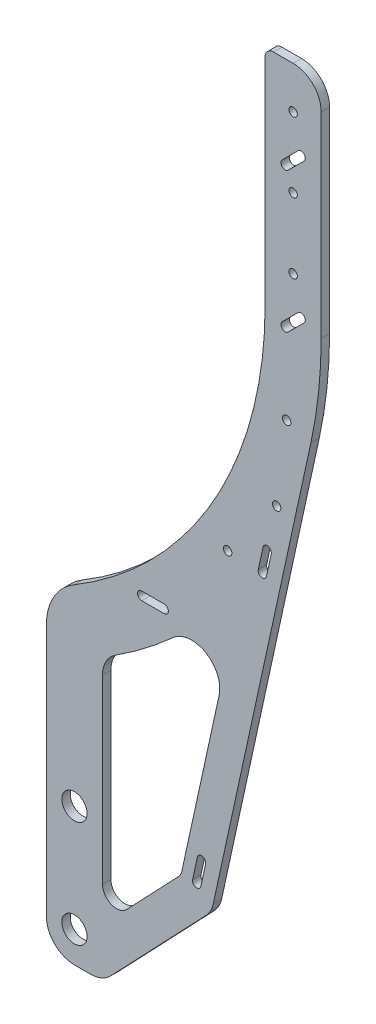
from build123d import *

# Parameters (mm, degrees)
SKETCH_1_W          = 20
SKETCH_1_H          = 60
SKETCH_1_R          = 4.5
EXTRUDE_1_DEPTH     = 3
EXTRUDE_2_DEPTH     = 3
EXTRUDE_START       = -3
EXTRUDE_3_DEPTH     = 3
FILLET_2_R          = 10
FILLET_3_R          = 20
FILLET_4_R          = 3
SKETCH_5_W          = 8
SKETCH_5_H          = 3
CUT_EXTRUDE_1_DEPTH = 319.896926922
SKETCH_7_R          = 1.5
CUT_EXTRUDE_2_DEPTH = 319.896926922
CUT_EXTRUDE_4_DEPTH = 10
EXTRUDE_4_DEPTH     = 3
FILLET_5_R          = 10
FILLET_6_R          = 10
FILLET_7_R          = 5
SKETCH_11_R         = 1.5
CUT_EXTRUDE_6_DEPTH = 319.896926922
SKETCH_12_R         = 1.5
CUT_EXTRUDE_7_DEPTH = 319.896926922


with BuildPart() as part:
    # 草图1 → 凸台-拉伸1 (new body)
    with BuildSketch(Plane.XY):
        with Locations((0, 19)):
            Rectangle(SKETCH_1_W, SKETCH_1_H)
        Circle(SKETCH_1_R, mode=Mode.SUBTRACT)
        with Locations((0, 38)):
            Circle(SKETCH_1_R, mode=Mode.SUBTRACT)
    extrude(amount=EXTRUDE_1_DEPTH)

    # 草图3 → 凸台-拉伸2 (add)
    with BuildSketch(Plane.XY.offset(3)):
        with BuildLine():
            Line((-10, 100.977093724), (-10, 79.00084746))
            ThreePointArc((-10, 79.00084746), (0.177205293, 83.704863402), (10, 89.110044035))
            ThreePointArc((10, 89.110044035), (67.140217047, 147.506329367), (88, 226.5))
            ThreePointArc((88, 226.5), (82.919333848, 266.5), (68, 303.959666924))
            Line((68, 303.959666924), (68, 226.5))
            ThreePointArc((68, 226.5), (46.91173197, 152.608187192), (-10, 100.977093724))
        make_face()
        with BuildLine():
            Line((-10, 79.00084746), (-10, 49))
            Line((-10, 49), (10, 49))
            Line((10, 49), (10, 89.110044035))
            ThreePointArc((10, 89.110044035), (0.177205293, 83.704863402), (-10, 79.00084746))
        make_face()
        with BuildLine():
            Line((68, 306.5), (68, 303.959666924))
            ThreePointArc((68, 303.959666924), (82.919333848, 266.5), (88, 226.5))
            Line((88, 226.5), (88, 306.5))
            Line((88, 306.5), (68, 306.5))
        make_face()
    extrude(amount=-EXTRUDE_2_DEPTH)

    # 草图4 → 凸台-拉伸3 (add)
    with BuildSketch(Plane(origin=(0, 0, 0), x_dir=(-1, 0, 0), z_dir=(0, 0, -1)).offset(EXTRUDE_START)):
        with BuildLine():
            Line((-40, -11), (-10, -11))
            Line((-10, -11), (-10, -1))
            Line((-10, -1), (-30, -1))
            Line((-30, -1), (-59.811855282, 135.804714527))
            ThreePointArc((-59.811855282, 135.804714527), (-74.827433124, 162.925595698), (-84.331190721, 192.433024677))
            Line((-84.331190721, 192.433024677), (-40, -11))
        make_face()
    extrude(amount=EXTRUDE_3_DEPTH)

    # 圆角2
    fillet_2_edges = [part.edges().sort_by_distance(p)[0] for p in [
        (88, 306.5, 1.5),
        (40, -11, 1.5),
        (-10, -11, 1.5),
    ]]
    fillet(fillet_2_edges, radius=FILLET_2_R)

    # 圆角3
    fillet_3_edges = [part.edges().sort_by_distance(p)[0] for p in [
        (-10, 100.977093724, 1.5),
    ]]
    fillet(fillet_3_edges, radius=FILLET_3_R)

    # 圆角4
    fillet_4_edges = [part.edges().sort_by_distance(p)[0] for p in [
        (68, 306.5, 1.5),
    ]]
    fillet(fillet_4_edges, radius=FILLET_4_R)

    # 草图5 → 切除-拉伸1 (cut, through all)
    with BuildSketch(Plane.XY.offset(3)):
        Polygon((46.77842194, 43.588901874), (43.847212114, 44.227657662), (42.143863348, 36.411098126), (45.075073174, 35.772342338), align=None)
        Polygon((70.199467474, 151.066595495), (68.496118708, 143.250035959), (65.564908882, 143.888791747), (67.268257648, 151.705351283), align=None)
        with Locations((28, 115)):
            Rectangle(SKETCH_5_W, SKETCH_5_H)
        Polygon((79.767766953, 280.389087297), (74.110912703, 274.732233047), (76.232233047, 272.610912703), (81.889087297, 278.267766953), align=None)
        Polygon((79.767766953, 230.389087297), (81.889087297, 228.267766953), (76.232233047, 222.610912703), (74.110912703, 224.732233047), align=None)
    extrude(amount=-CUT_EXTRUDE_1_DEPTH, mode=Mode.SUBTRACT)

    # 草图7 → 切除-拉伸2 (cut, through all)
    with BuildSketch(Plane(origin=(0, 0, 0), x_dir=(-1, 0, 0), z_dir=(0, 0, -1))):
        with Locations((-72.125207072, 166.801384551)):
            Circle(SKETCH_7_R)
        with Locations((-75.700287711, 195.105334687)):
            Circle(SKETCH_7_R)
        with Locations(Location((-54.63925576, 144.259505713, 0), (0, 0, 180))):
            Circle(SKETCH_7_R)
    extrude(amount=-CUT_EXTRUDE_2_DEPTH, mode=Mode.SUBTRACT)

    # 草图8 → 切除-拉伸4 (cut)
    with BuildSketch(Plane.XY.offset(3)):
        Polygon((37.268809589, 32.356106534), (48.895829905, 29.822399649), (39.17112789, -58.646231881), (10, -11), (10, -1), align=None)
    extrude(amount=-CUT_EXTRUDE_4_DEPTH, mode=Mode.SUBTRACT)

    # 草图9 → 凸台-拉伸4 (add)
    with BuildSketch(Plane.XY.offset(3)):
        Polygon((48.895829905, 29.822399649), (10, -11), (10, -0.039068456), (10, 6.39592954), (38.020150061, 35.803960345), (37.268809589, 32.356106534), align=None)
    extrude(amount=-EXTRUDE_4_DEPTH)

    # 圆角5
    fillet_5_edges = [part.edges().sort_by_distance(p)[0] for p in [
        (10, -11, 1.5),
        (48.895829905, 29.822399649, 1.5),
    ]]
    fillet(fillet_5_edges, radius=FILLET_5_R)

    # 圆角6
    fillet_6_edges = [part.edges().sort_by_distance(p)[0] for p in [
        (10, 89.110044035, 1.5),
        (59.811855282, 135.804714527, 1.5),
    ]]
    fillet(fillet_6_edges, radius=FILLET_6_R)

    # 圆角7
    fillet_7_edges = [part.edges().sort_by_distance(p)[0] for p in [
        (10, 6.39592954, 1.5),
        (38.020150061, 35.803960345, 1.5),
    ]]
    fillet(fillet_7_edges, radius=FILLET_7_R)

    # 草图11 → 切除-拉伸6 (cut, through all)
    with BuildSketch(Plane.XY.offset(3)):
        with Locations((24, 115)):
            Circle(SKETCH_11_R)
        with Locations((32, 115)):
            Circle(SKETCH_11_R)
        with Locations((43.609468261, 36.091720232)):
            Circle(SKETCH_11_R)
        with Locations((45.312817027, 43.908279768)):
            Circle(SKETCH_11_R)
        with Locations((67.030513795, 143.569413853)):
            Circle(SKETCH_11_R)
        with Locations((68.733862561, 151.385973389)):
            Circle(SKETCH_11_R)
        with Locations((80.828427125, 229.328427125)):
            Circle(SKETCH_11_R)
        with Locations((75.171572875, 223.671572875)):
            Circle(SKETCH_11_R)
        with Locations((80.828427125, 279.328427125)):
            Circle(SKETCH_11_R)
        with Locations((75.171572875, 273.671572875)):
            Circle(SKETCH_11_R)
    extrude(amount=-CUT_EXTRUDE_6_DEPTH, mode=Mode.SUBTRACT)

    # 草图12 → 切除-拉伸7 (cut, through all)
    with BuildSketch(Plane(origin=(0, 0, 0), x_dir=(-1, 0, 0), z_dir=(0, 0, -1))):
        with Locations((-78, 291.5)):
            Circle(SKETCH_12_R)
        with Locations((-78, 266.5)):
            Circle(SKETCH_12_R)
        with Locations((-78, 241.5)):
            Circle(SKETCH_12_R)
    extrude(amount=-CUT_EXTRUDE_7_DEPTH, mode=Mode.SUBTRACT)


solid = part.part
